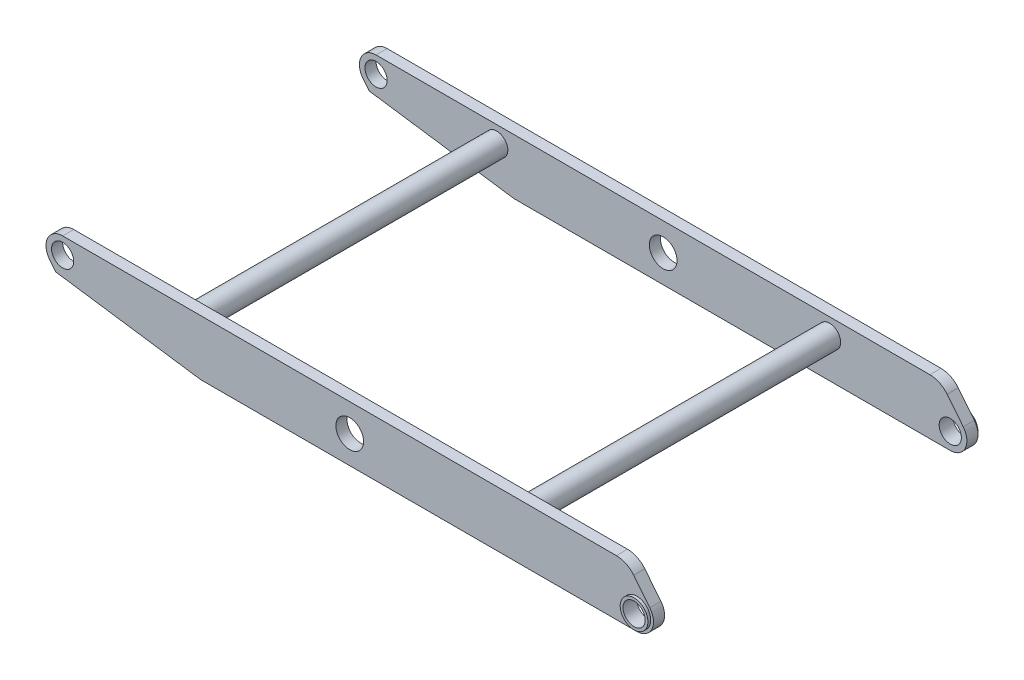
from build123d import *

# Parameters (mm, degrees)
SKETCH_1_R               = 2.5
EXTRUDE_1_DEPTH          = 2
SKETCH_4_R               = 2.5
EXTRUDE_3_DEPTH          = 0.5
CUT_EXTRUDE_1_DEPTH      = 56.022289153
CUT_EXTRUDE_1_DEPTH_BACK = 56.022289153
SKETCH_2_R               = 2
SKETCH_3_R               = 2
EXTRUDE_2_DEPTH          = 29.25


with BuildPart() as part:
    # 草圖1 → 填料-伸長1 (new body)
    with BuildSketch(Plane.XY):
        with BuildLine():
            Line((-53.002575001, -1.246781249), (-26.890819753, -5))
            Line((-26.890819753, -5), (51.758125458, -5))
            ThreePointArc((51.758125458, -5), (54.462035166, -3.299566191), (54.100731886, -0.125914857))
            Line((54.100731886, -0.125914857), (51.200975848, 3.49878019))
            ThreePointArc((51.200975848, 3.49878019), (49.810255532, 4.605212945), (48.07750061, 5))
            Line((48.07750061, 5), (-51.758125458, 5))
            ThreePointArc((-51.758125458, 5), (-54.462035166, 3.299566191), (-54.100731886, 0.125914857))
            Line((-54.100731886, 0.125914857), (-53.002575001, -1.246781249))
        make_face()
        Circle(SKETCH_1_R, mode=Mode.SUBTRACT)
    extrude(amount=EXTRUDE_1_DEPTH)

    # 草圖4 → 填料-伸長3 (add)
    with BuildSketch(Plane.XY.offset(2)):
        with Locations((51.758125458, -2)):
            Circle(SKETCH_4_R)
    extrude(amount=EXTRUDE_3_DEPTH)

    # 草圖2 → 除料-伸長1 (cut, two sides: drawn at the far end of the back side and taken through both)
    with BuildSketch(Plane.XY.offset(2).offset(-CUT_EXTRUDE_1_DEPTH_BACK)):
        with Locations((-51.758125458, 2)):
            Circle(SKETCH_2_R)
        with Locations((51.758125458, -2)):
            Circle(SKETCH_2_R)
    extrude(amount=CUT_EXTRUDE_1_DEPTH + CUT_EXTRUDE_1_DEPTH_BACK, mode=Mode.SUBTRACT)

    # 草圖3 → 填料-伸長2 (add)
    with BuildSketch(Plane(origin=(0, 0, 2), x_dir=(-1, 0, 0), z_dir=(0, 0, -1))):
        with Locations(Location((30, 2, 0), (0, 0, 180))):
            Circle(SKETCH_3_R)
        with Locations(Location((-30, 2, 0), (0, 0, 180))):
            Circle(SKETCH_3_R)
    extrude(amount=EXTRUDE_2_DEPTH)

    # 鏡射1: part across plane


with BuildPart() as part_1:
    add(part.part)
    add(part.part.mirror(Plane(origin=(-30, 2, -27.25), x_dir=(1, 0, 0), z_dir=(0, 0, -1))))


solid = part_1.part
